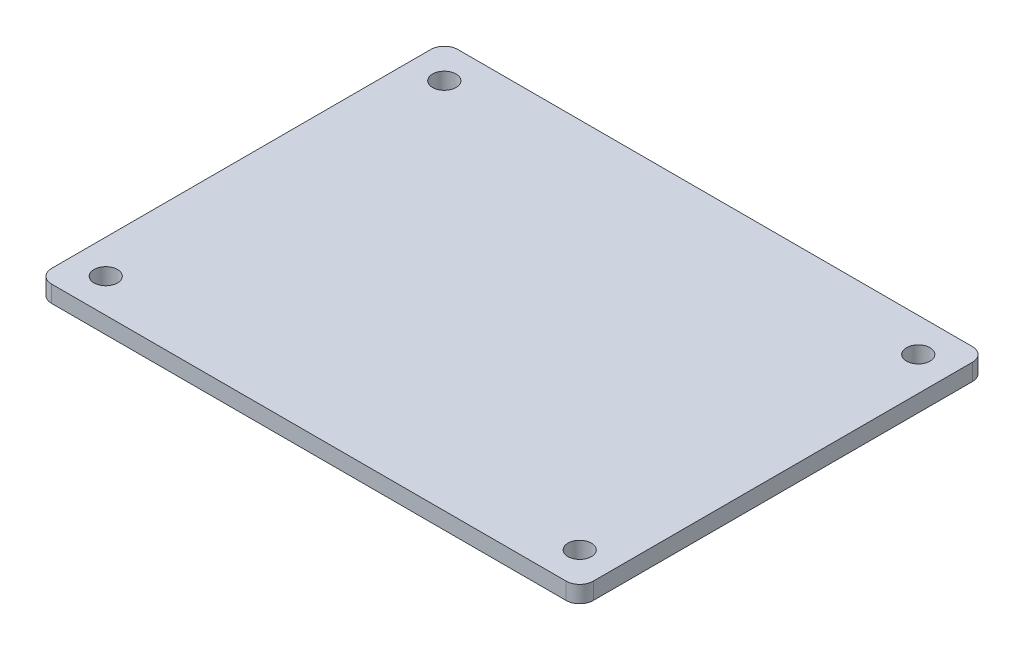
from build123d import *

# Parameters (mm, degrees)
SKETCH1_W           = 50.8
SKETCH1_H           = 38.1
SKETCH1_R           = 1.1
BOSS_EXTRUDE1_DEPTH = 1.5748
FILLET1_R           = 1.27


with BuildPart() as part:
    # Sketch1 → Boss-Extrude1 (new body)
    with BuildSketch(Plane(origin=(0, 0, 0), x_dir=(1, 0, 0), z_dir=(0, 1, 0))):
        Rectangle(SKETCH1_W, SKETCH1_H)
        with Locations(Location((22.225, 15.875, 0), (0, 0, 270))):
            Circle(SKETCH1_R, mode=Mode.SUBTRACT)
        with Locations(Location((22.225, -15.875, 0), (0, 0, 270))):
            Circle(SKETCH1_R, mode=Mode.SUBTRACT)
        with Locations(Location((-22.225, -15.875, 0), (0, 0, 270))):
            Circle(SKETCH1_R, mode=Mode.SUBTRACT)
        with Locations(Location((-22.225, 15.875, 0), (0, 0, 270))):
            Circle(SKETCH1_R, mode=Mode.SUBTRACT)
    extrude(amount=BOSS_EXTRUDE1_DEPTH)

    # Fillet1
    fillet1_edges = [part.edges().sort_by_distance(p)[0] for p in [
        (25.4, 0.7874, 19.05),
        (-25.4, 0.7874, 19.05),
        (-25.4, 0.7874, -19.05),
        (25.4, 0.7874, -19.05),
    ]]
    fillet(fillet1_edges, radius=FILLET1_R)


solid = part.part
